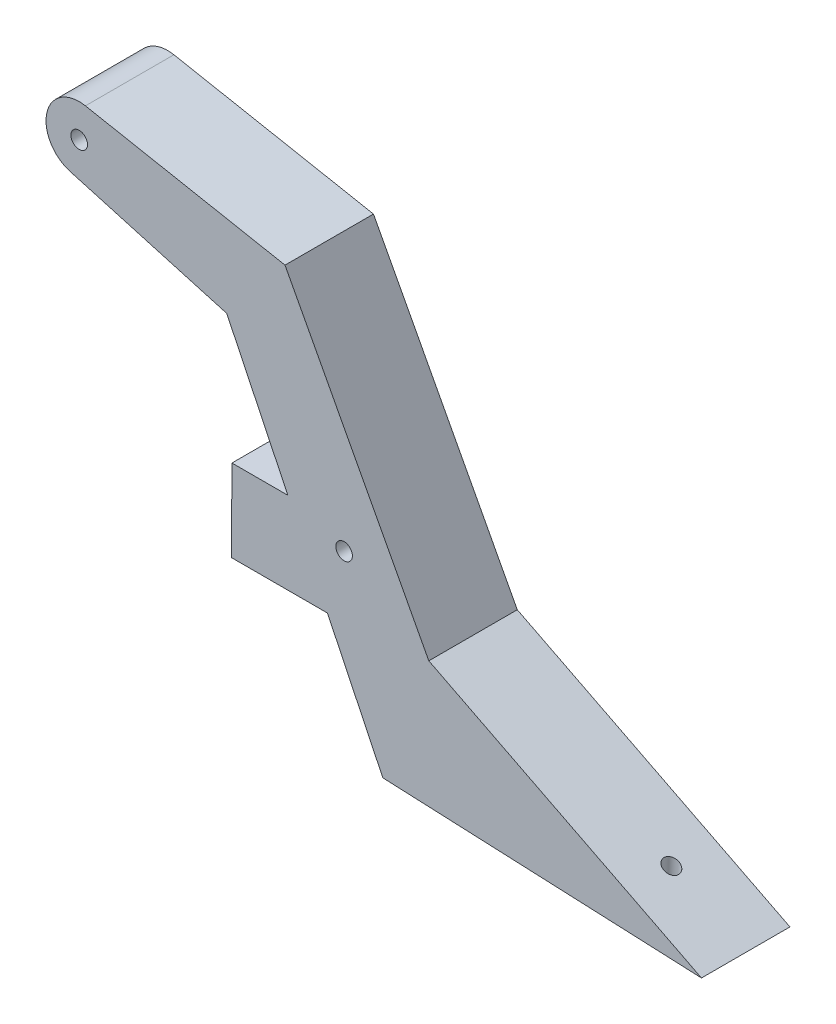
from build123d import *

# Parameters (mm, degrees)
SKETCH_1_R          = 1.5
EXTRUDE_1_DEPTH     = 16
SKETCH_2_R          = 1.35
CUT_EXTRUDE_1_DEPTH = 10
CUT_EXTRUDE_2_DEPTH = 33
EXTRUDE_2_DEPTH     = 16
SKETCH_5_R          = 1.5
CUT_EXTRUDE_3_DEPTH = 24
SKETCH_7_R          = 1.8
CUT_EXTRUDE_5_DEPTH = 10


with BuildPart() as part:
    # 草图1 → 凸台-拉伸1 (new body)
    with BuildSketch(Plane.XY):
        with BuildLine():
            Line((1.126380295, 5.893323971), (37.220974686, -1.005370225))
            Line((37.220974686, -1.005370225), (63.227984205, -49.979924472))
            Line((63.227984205, -49.979924472), (112.538061605, -75))
            Line((112.538061605, -75), (53.330616959, -72.391905084))
            Line((53.330616959, -72.391905084), (49.915441771, -64.88738307))
            Line((49.915441771, -64.88738307), (26.682733599, -13.835720919))
            Line((26.682733599, -13.835720919), (-1.643050648, -5.77064854))
            ThreePointArc((-1.643050648, -5.77064854), (-5.837705093, 1.386073321), (1.126380295, 5.893323971))
        make_face()
        Circle(SKETCH_1_R, mode=Mode.SUBTRACT)
    extrude(amount=EXTRUDE_1_DEPTH)

    # 草图2 → 切除-拉伸1 (cut)
    with BuildSketch(Plane(origin=(-3.079413203, -69.907036606, 0), x_dir=(0.9990312032291818, -0.044007442262116094, 0), z_dir=(-0.044007442262116094, -0.9990312032291818, 0))):
        with Locations((66, 8)):
            Circle(SKETCH_2_R)
        with Locations((102, 8)):
            Circle(SKETCH_2_R)
        with Locations((84, 8)):
            Circle(SKETCH_2_R)
    extrude(amount=-CUT_EXTRUDE_1_DEPTH, mode=Mode.SUBTRACT)

    # 草图3 → 切除-拉伸2 (cut)
    with BuildSketch(Plane.XY.offset(16)):
        Polygon((26.682733599, -13.835720919), (54.911117554, -72.461526322), (53.330616959, -72.391905084), align=None)
    extrude(amount=-CUT_EXTRUDE_2_DEPTH, mode=Mode.SUBTRACT)

    # 草图4 → 凸台-拉伸2 (add)
    with BuildSketch(Plane.XY.offset(16)):
        Polygon((44.895473102, -51.660646486), (37.739057149, -36.797923572), (27.624132339, -36.797923572), (27.532134383, -51.660646486), align=None)
    extrude(amount=-EXTRUDE_2_DEPTH)

    # 草图5 → 切除-拉伸3 (cut)
    with BuildSketch(Plane.XY.offset(16)):
        with Locations((47.911117554, -40.461526322)):
            Circle(SKETCH_5_R)
    extrude(amount=-CUT_EXTRUDE_3_DEPTH, mode=Mode.SUBTRACT)

    # 草图7 → 切除-拉伸5 (cut)
    with BuildSketch(Plane(origin=(27.85083871, -0.172392383, 0), x_dir=(0, 0, 1), z_dir=(-0.9999808434581536, 0.006189726708003564, 0))):
        with Locations(Location((8, -44.015961614, 0), (0, 0, 270))):
            Circle(SKETCH_7_R)
    extrude(amount=-CUT_EXTRUDE_5_DEPTH, mode=Mode.SUBTRACT)


solid = part.part
